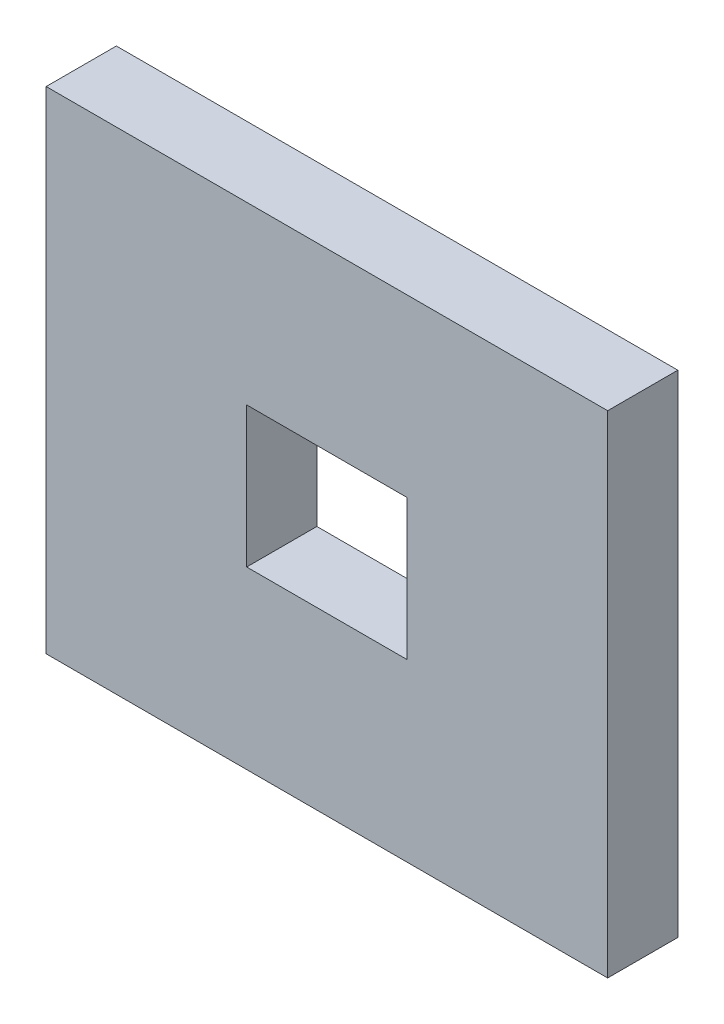
from build123d import *

# Parameters (mm, degrees)
SKETCH1_W           = 80
SKETCH1_H           = 70
SKETCH1_W_2         = 22.857142858
SKETCH1_H_2         = 20
BOSS_EXTRUDE1_DEPTH = 10


with BuildPart() as part:
    # Sketch1 → Boss-Extrude1 (new body)
    with BuildSketch(Plane.XY):
        Rectangle(SKETCH1_W, SKETCH1_H)
        Rectangle(SKETCH1_W_2, SKETCH1_H_2, mode=Mode.SUBTRACT)
    extrude(amount=BOSS_EXTRUDE1_DEPTH)


solid = part.part
